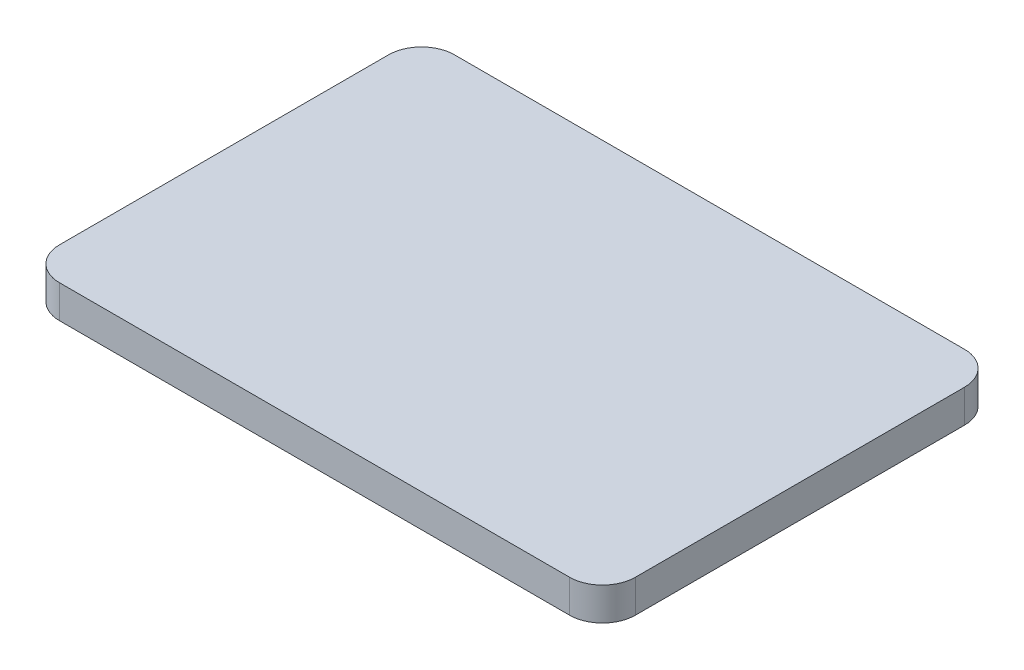
from build123d import *

# Parameters (mm, degrees)
DODANIE_WYCI_GNI_CIE3_DEPTH = 1


with BuildPart() as part:
    # Szkic1 → Dodanie-wyciągnięcie3 (new body)
    with BuildSketch(Plane(origin=(0, 0, 0), x_dir=(1, 0, 0), z_dir=(0, 1, 0))):
        with BuildLine():
            Line((0, 1), (0, 11))
            ThreePointArc((0, 11), (0.292893219, 11.707106781), (1, 12))
            Line((1, 12), (16.5, 12))
            ThreePointArc((16.5, 12), (17.207106781, 11.707106781), (17.5, 11))
            Line((17.5, 11), (17.5, 1))
            ThreePointArc((17.5, 1), (17.207106781, 0.292893219), (16.5, 0))
            Line((16.5, 0), (1, 0))
            ThreePointArc((1, 0), (0.292893219, 0.292893219), (0, 1))
        make_face()
    extrude(amount=DODANIE_WYCI_GNI_CIE3_DEPTH)


solid = part.part
